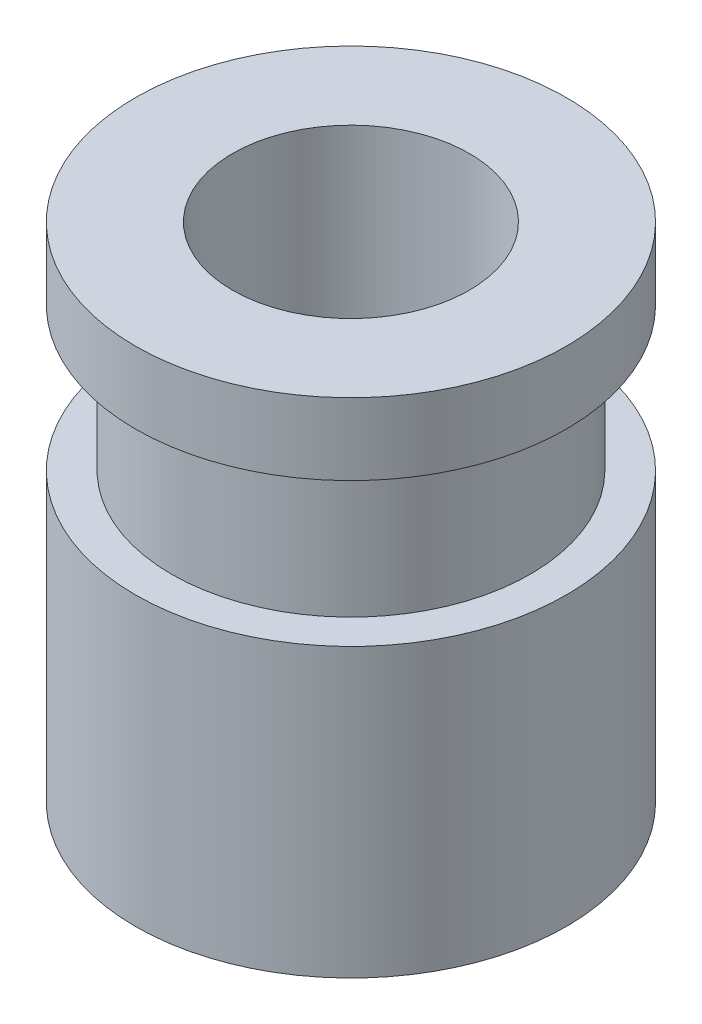
from build123d import *

# Parameters (mm, degrees)
SKETCH_1_R      = 3
SKETCH_1_R_2    = 1.65
EXTRUDE_1_DEPTH = 4
SKETCH_2_R      = 2.5
SKETCH_2_R_2    = 1.65
EXTRUDE_2_DEPTH = 2
SKETCH_3_R      = 3
SKETCH_3_R_2    = 1.65
EXTRUDE_3_DEPTH = 1


with BuildPart() as part:
    # 草图1 → 凸台-拉伸1 (new body)
    with BuildSketch(Plane(origin=(0, 0, 0), x_dir=(1, 0, 0), z_dir=(0, 1, 0))):
        with Locations(Location((0, 0, 0), (0, 0, 270))):
            Circle(SKETCH_1_R)
        with Locations(Location((0, 0, 0), (0, 0, 270))):
            Circle(SKETCH_1_R_2, mode=Mode.SUBTRACT)
    extrude(amount=EXTRUDE_1_DEPTH)

    # 草图2 → 凸台-拉伸2 (add)
    with BuildSketch(Plane(origin=(0, 4, 0), x_dir=(1, 0, 0), z_dir=(0, 1, 0))):
        with Locations(Location((0, 0, 0), (0, 0, 270))):
            Circle(SKETCH_2_R)
        with Locations(Location((0, 0, 0), (0, 0, 270))):
            Circle(SKETCH_2_R_2, mode=Mode.SUBTRACT)
    extrude(amount=EXTRUDE_2_DEPTH)

    # 草图3 → 凸台-拉伸3 (add)
    with BuildSketch(Plane(origin=(0, 6, 0), x_dir=(1, 0, 0), z_dir=(0, 1, 0))):
        with Locations(Location((0, 0, 0), (0, 0, 270))):
            Circle(SKETCH_3_R)
        with Locations(Location((0, 0, 0), (0, 0, 270))):
            Circle(SKETCH_3_R_2, mode=Mode.SUBTRACT)
    extrude(amount=EXTRUDE_3_DEPTH)


solid = part.part
